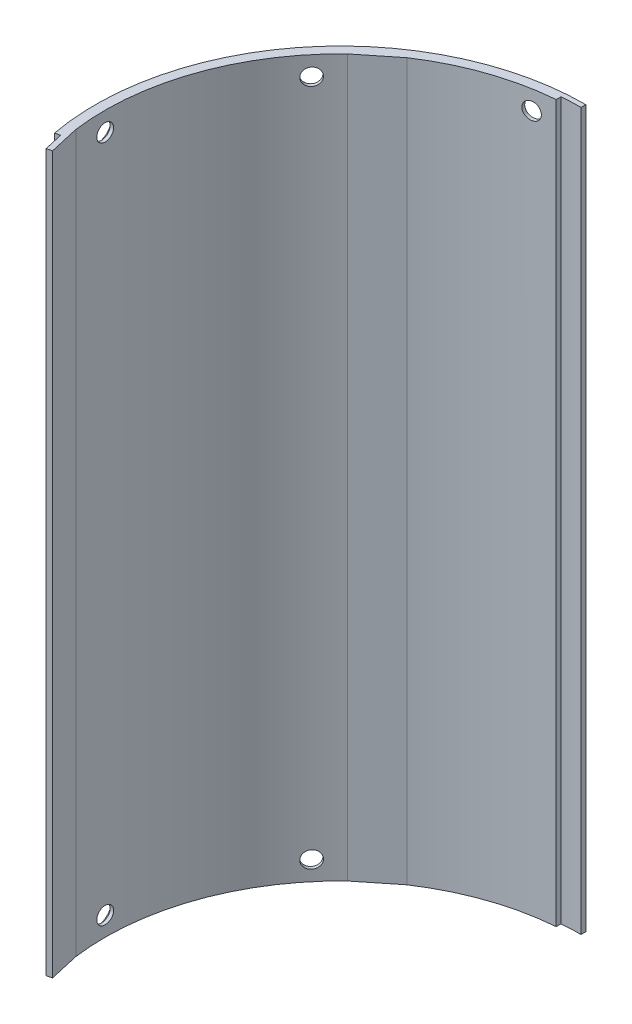
from build123d import *

# Parameters (mm, degrees)
EXTRUDE_1_DEPTH          = 149
SKETCH_7_R               = 3.25
CUT_EXTRUDE_3_DEPTH      = 1.3
SKETCH_8_R               = 1.75
CUT_EXTRUDE_4_DEPTH      = 166.14263547
PATTERN_CIRCULAR_1_COUNT = 3
PATTERN_CIRCULAR_1_ANGLE = 40
SKETCH_9_R               = 3.25
CUT_EXTRUDE_5_DEPTH      = 1.3
SKETCH_10_R              = 1.75
CUT_EXTRUDE_6_DEPTH      = 166.14263547
PATTERN_CIRCULAR_2_COUNT = 5
PATTERN_CIRCULAR_2_ANGLE = 80


with BuildPart() as part:
    # Эскиз1 → Бобышка-Вытянуть1 (new body)
    with BuildSketch(Plane(origin=(0, 0, 0), x_dir=(1, 0, 0), z_dir=(0, 1, 0))):
        with BuildLine():
            Line((-47.135590279, -12.793597189), (-48.562738521, -6.531495034))
            ThreePointArc((-48.562738521, -6.531495034), (-46.263287314, 16.146462365), (-33.952444786, 35.330319742))
            Line((-33.952444786, 35.330319742), (-27.047555214, 40.858655839))
            ThreePointArc((-27.047555214, 40.858655839), (-25.453757982, 41.870111113), (-23.822185811, 42.819428571))
            ThreePointArc((-23.822185811, 42.819428571), (-14.231160733, 46.887888246), (-3.996798719, 48.836723887))
            Line((-3.996798719, 48.836723887), (-3.996798719, 49.84))
            ThreePointArc((-3.996798719, 49.84), (-2, 49.959983987), (0, 50))
            Line((0, 50), (0, 51))
            ThreePointArc((0, 51), (-39.236846594, 32.580206711), (-50.131159715, -9.373730613))
            Line((-50.131159715, -9.373730613), (-49.096909721, -9.138022536))
            Line((-49.096909721, -9.138022536), (-48.208090279, -13.038022536))
            Line((-48.208090279, -13.038022536), (-47.135590279, -12.793597189))
        make_face()
    extrude(amount=EXTRUDE_1_DEPTH)

    # Эскиз7 → Вырез-Вытянуть3 (cut)
    with BuildSketch(Plane.ZY.offset(51)):
        with Locations((0, 4)):
            Circle(SKETCH_7_R)
    cut_extrude_3 = extrude(amount=-CUT_EXTRUDE_3_DEPTH, mode=Mode.SUBTRACT)

    # Эскиз8 → Вырез-Вытянуть4 (cut, through all)
    with BuildSketch(Plane.ZY.offset(49.7)):
        with Locations((0, 4)):
            Circle(SKETCH_8_R)
    cut_extrude_4 = extrude(amount=-CUT_EXTRUDE_4_DEPTH, mode=Mode.SUBTRACT)

    # Круговой массив1: Вырез-Вытянуть3, Вырез-Вытянуть4 ×3 about axis, 1 skipped
    pattern_circular_1_axis = Axis((0, 0, 0), (0, -1, 0))
    add([cut_extrude_3.rotate(pattern_circular_1_axis, i * PATTERN_CIRCULAR_1_ANGLE / (PATTERN_CIRCULAR_1_COUNT - 1)) for i in range(1, PATTERN_CIRCULAR_1_COUNT) if i not in (1,)], mode=Mode.SUBTRACT)
    add([cut_extrude_4.rotate(pattern_circular_1_axis, i * PATTERN_CIRCULAR_1_ANGLE / (PATTERN_CIRCULAR_1_COUNT - 1)) for i in range(1, PATTERN_CIRCULAR_1_COUNT) if i not in (1,)], mode=Mode.SUBTRACT)

    # Эскиз9 → Вырез-Вытянуть5 (cut)
    with BuildSketch(Plane.ZY.offset(51)):
        with Locations((0, 145)):
            Circle(SKETCH_9_R)
    cut_extrude_5 = extrude(amount=-CUT_EXTRUDE_5_DEPTH, mode=Mode.SUBTRACT)

    # Эскиз10 → Вырез-Вытянуть6 (cut, through all)
    with BuildSketch(Plane.ZY.offset(49.7)):
        with Locations((0, 145)):
            Circle(SKETCH_10_R)
    cut_extrude_6 = extrude(amount=-CUT_EXTRUDE_6_DEPTH, mode=Mode.SUBTRACT)

    # Круговой массив2: Вырез-Вытянуть5, Вырез-Вытянуть6 ×5 about axis, 2 skipped
    pattern_circular_2_axis = Axis((0, 149, 0), (0, -1, 0))
    add([cut_extrude_5.rotate(pattern_circular_2_axis, i * PATTERN_CIRCULAR_2_ANGLE / (PATTERN_CIRCULAR_2_COUNT - 1)) for i in range(1, PATTERN_CIRCULAR_2_COUNT) if i not in (1, 3)], mode=Mode.SUBTRACT)
    add([cut_extrude_6.rotate(pattern_circular_2_axis, i * PATTERN_CIRCULAR_2_ANGLE / (PATTERN_CIRCULAR_2_COUNT - 1)) for i in range(1, PATTERN_CIRCULAR_2_COUNT) if i not in (1, 3)], mode=Mode.SUBTRACT)


solid = part.part
